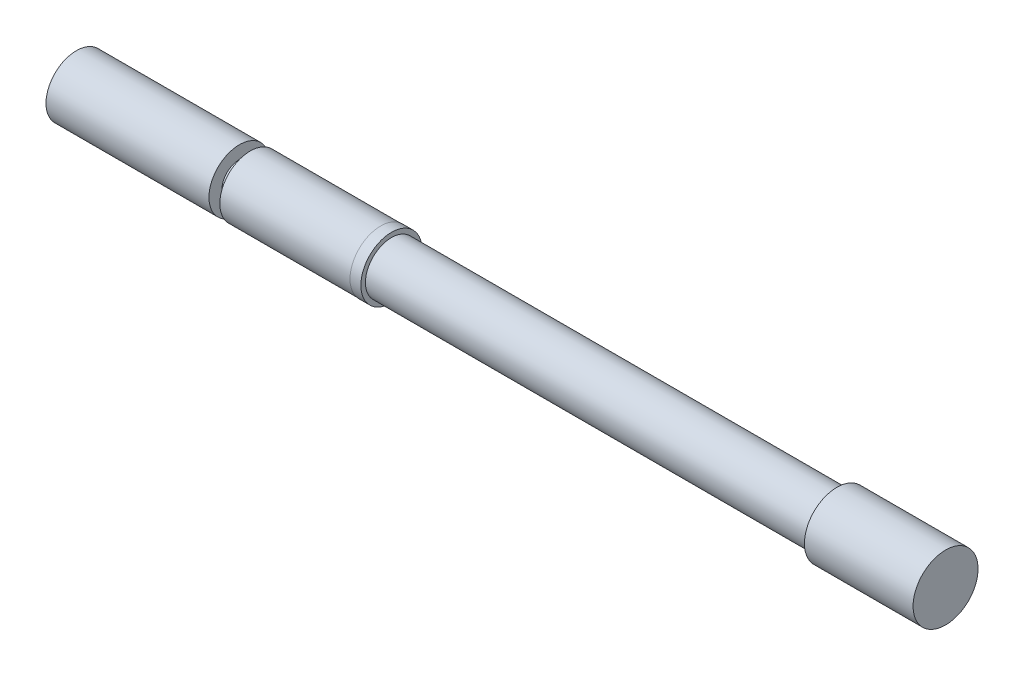
from build123d import *


with BuildPart() as part:
    # Sketch3 → Revolve1 (revolve)
    with BuildSketch(Plane.XY, mode=Mode.PRIVATE) as revolve1_sk:
        Polygon((0, 0), (400, 0), (400, 14.956667457), (350, 14.956667457), (350, 12), (145, 12), (145, 14.094661295), (140, 14.094661295), (140, 14), (80, 14), (80, 8.086665086), (75, 8.086665086), (75, 14), (0, 14), align=None)
    revolve(revolve1_sk.sketch.rotate(Axis((0, 0, 0), (1, 0, 0)), 90), axis=Axis((0, 0, 0), (1, 0, 0)))


solid = part.part
